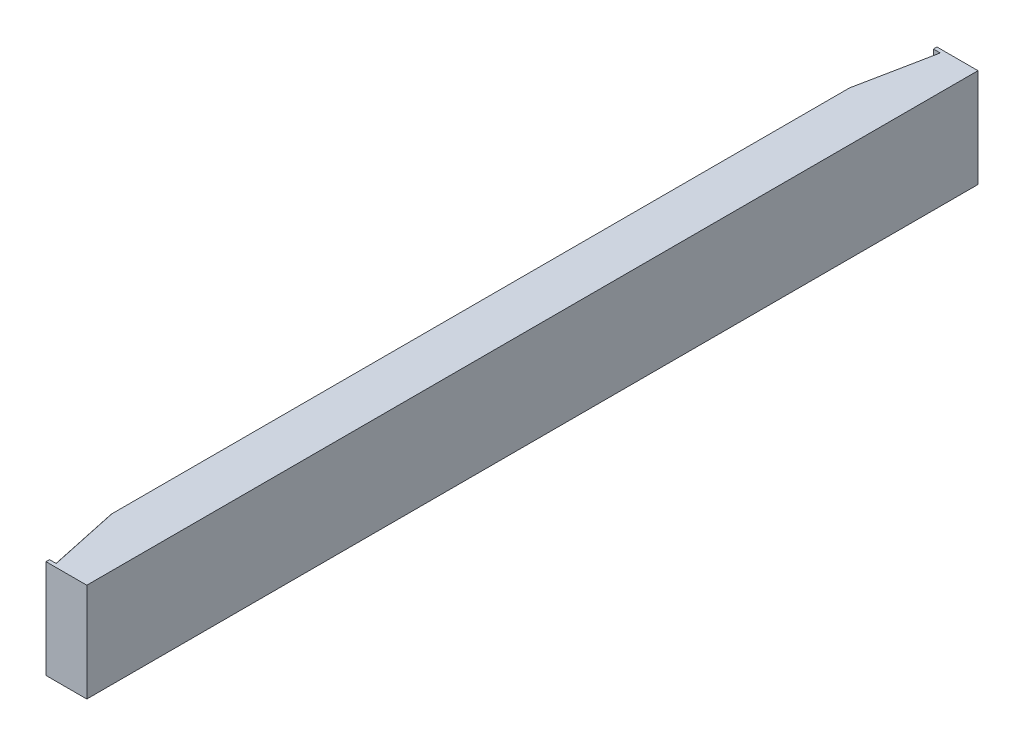
from build123d import *

# Parameters (mm, degrees)
BOSS_EXTRUDE1_DEPTH      = 500
BOSS_EXTRUDE1_DEPTH_BACK = 1600
SKETCH1_W                = 150
SKETCH1_H                = 300
CUT_EXTRUDE1_DEPTH       = 2309
SKETCH5_W                = 150
SKETCH5_H                = 300
BOSS_EXTRUDE2_DEPTH      = 350
SKETCH6_W                = 210
SKETCH6_H                = 250
CUT_EXTRUDE4_DEPTH       = 45
CUT_EXTRUDE5_DEPTH       = 1500
CUT_EXTRUDE7_DEPTH       = 355
FILLET8_R                = 1.5
FILLET9_R                = 1.5
SKETCH9_W                = 150
SKETCH9_H                = 300
BOSS_EXTRUDE3_DEPTH      = 300
SKETCH10_W               = 70
SKETCH10_H               = 230
CUT_EXTRUDE17_DEPTH      = 140
SKETCH11_W               = 125
SKETCH11_H               = 10.75
BOSS_EXTRUDE4_DEPTH      = 300
CUT_EXTRUDE18_DEPTH      = 394
SWEEP1_PROFILE_R         = 7.5
SKETCH50_R               = 4.335134875
BOSS_EXTRUDE5_DEPTH      = 20
CUT_EXTRUDE19_DEPTH      = 30
CUT_EXTRUDE19_DEPTH_BACK = 250
SKETCH82_W               = 45
SKETCH82_H               = 30
CUT_EXTRUDE20_DEPTH      = 32
CUT_EXTRUDE20_DEPTH_BACK = 250
SKETCH85_W               = 45
SKETCH85_H               = 30


with BuildPart() as part:
    # Sketch1 → Boss-Extrude1 (new, two sides: drawn at the far end of the back side and taken through both)
    with BuildSketch(Plane.XY.offset(-BOSS_EXTRUDE1_DEPTH_BACK)):
        with Locations((375, -2.824081205)):
            Rectangle(SKETCH1_W, SKETCH1_H)
    extrude(amount=BOSS_EXTRUDE1_DEPTH + BOSS_EXTRUDE1_DEPTH_BACK)

    # Sketch2 → Cut-Extrude1 (cut)
    with BuildSketch(Plane(origin=(0, 0, -1600), x_dir=(-1, 0, 0), z_dir=(0, 0, -1))):
        Polygon((-300, 49.675918795), (-300, 69.675918795), (-325, 69.675918795), (-325, 77.175918795), (-345, 77.175918795), (-345, 42.175918795), (-325, 42.175918795), (-325, 49.675918795), align=None)
        Polygon((-300, 129.675918795), (-325, 129.675918795), (-325, 137.175918795), (-345, 137.175918795), (-345, 102.175918795), (-325, 102.175918795), (-325, 109.675918795), (-300, 109.675918795), align=None)
        Polygon((-300, -10.324081205), (-300, 9.675918795), (-325, 9.675918795), (-325, 17.175918795), (-345, 17.175918795), (-345, -17.824081205), (-325, -17.824081205), (-325, -10.324081205), align=None)
        Polygon((-300, -70.324081205), (-300, -50.324081205), (-325, -50.324081205), (-325, -42.824081205), (-345, -42.824081205), (-345, -77.824081205), (-325, -77.824081205), (-325, -70.324081205), align=None)
        Polygon((-300, -130.324081205), (-300, -110.324081205), (-325, -110.324081205), (-325, -102.824081205), (-345, -102.824081205), (-345, -137.824081205), (-325, -137.824081205), (-325, -130.324081205), align=None)
    extrude(amount=-CUT_EXTRUDE1_DEPTH, mode=Mode.SUBTRACT)

    # Sketch5 → Boss-Extrude2 (add)
    with BuildSketch(Plane.XY.offset(500)):
        with Locations((375, -2.824081205)):
            Rectangle(SKETCH5_W, SKETCH5_H)
    extrude(amount=BOSS_EXTRUDE2_DEPTH)

    # Sketch6 → Cut-Extrude4 (cut)
    with BuildSketch(Plane.ZY.offset(-300)):
        with Locations((685, -2.824081205)):
            Rectangle(SKETCH6_W, SKETCH6_H)
    extrude(amount=-CUT_EXTRUDE4_DEPTH, mode=Mode.SUBTRACT)

    # Sketch7 → Cut-Extrude5 (cut, symmetric)
    with BuildSketch(Plane.XZ.offset(-122.175918795)):
        Polygon((300, 580), (345, 790), (300, 790), align=None)
    extrude(amount=CUT_EXTRUDE5_DEPTH, both=True, mode=Mode.SUBTRACT)

    # Sketch8 → Cut-Extrude7 (cut)
    with BuildSketch(Plane.XZ.offset(152.824081205)):
        Polygon((450, 850), (450, 800.747642435), (325, 800.747642435), (325, 790), (300, 790), (300, 850), align=None)
    extrude(amount=-CUT_EXTRUDE7_DEPTH, mode=Mode.SUBTRACT)

    # Fillet8
    fillet8_edges = [part.edges().sort_by_distance(p)[0] for p in [
        (325, -2.824081205, 790),
        (325, 147.175918795, 795.373821218),
        (325, -2.824081205, 800.747642435),
        (325, -152.824081205, 795.373821218),
    ]]
    fillet(fillet8_edges, radius=FILLET8_R)

    # Fillet9
    fillet9_edges = [part.edges().sort_by_distance(p)[0] for p in [
        (322.5, -152.824081205, 685),
        (322.5, 147.175918795, 685),
        (322.5, 122.175918795, 685),
        (322.5, -127.824081205, 685),
    ]]
    fillet(fillet9_edges, radius=FILLET9_R)

    # Sketch9 → Boss-Extrude3 (add)
    with BuildSketch(Plane(origin=(0, 0, -1600), x_dir=(-1, 0, 0), z_dir=(0, 0, -1))):
        with Locations((-375, -2.824081205)):
            Rectangle(SKETCH9_W, SKETCH9_H)
    extrude(amount=BOSS_EXTRUDE3_DEPTH)

    # Sketch10 → Cut-Extrude17 (cut, symmetric)
    with BuildSketch(Plane(origin=(0, -2.824081205, 0), x_dir=(-1, 0, 0), z_dir=(0, -1, 0))):
        with Locations((-335, 1785)):
            Rectangle(SKETCH10_W, SKETCH10_H)
    extrude(amount=CUT_EXTRUDE17_DEPTH, both=True, mode=Mode.SUBTRACT)

    # Sketch11 → Boss-Extrude4 (add)
    with BuildSketch(Plane.XZ.offset(152.824081205)):
        with Locations((387.5, -1905.375)):
            Rectangle(SKETCH11_W, SKETCH11_H)
    extrude(amount=-BOSS_EXTRUDE4_DEPTH)

    # Sketch13 → Cut-Extrude18 (cut)
    with BuildSketch(Plane.XZ.offset(152.824081205)):
        Polygon((300, -1900), (345.980080602, -1900), (300, -1670), align=None)
    extrude(amount=-CUT_EXTRUDE18_DEPTH, mode=Mode.SUBTRACT)

    # Sweep1: sweep along a path in Sketch15
    with BuildLine(Plane.XY.offset(-1449.252357565)) as sweep1_path:
        Line((350, -145.902648046), (350, -197.264838167))
        ThreePointArc((350, -197.264838167), (347.071067812, -204.335905979), (340, -207.264838167))
        Line((340, -207.264838167), (304.112930958, -207.264838167))
    # Sweep1 profile (on start of the path) → Sweep1 (sweep)
    with BuildSketch(Plane(origin=(350, -145.902648046, -1449.252357565), x_dir=(0, 0, -1), z_dir=(0, -1, 0))):
        Circle(SWEEP1_PROFILE_R)
    sweep(path=sweep1_path.line)

    # Sketch50 → Boss-Extrude5 (add)
    with BuildSketch(Plane.ZY.offset(-304.112930958)):
        with Locations((-1449.252357565, -207.264838167)):
            Circle(SKETCH50_R)
    extrude(amount=BOSS_EXTRUDE5_DEPTH)

    # Sketch82 → Cut-Extrude19 (cut, two sides: drawn at the far end of the back side and taken through both)
    with BuildSketch(Plane.XZ.offset(110.324081205).offset(-CUT_EXTRUDE19_DEPTH_BACK)):
        with Locations((322.5, -1545)):
            Rectangle(SKETCH82_W, SKETCH82_H)
    extrude(amount=CUT_EXTRUDE19_DEPTH + CUT_EXTRUDE19_DEPTH_BACK, mode=Mode.SUBTRACT)

    # Sketch85 → Cut-Extrude20 (cut, two sides: drawn at the far end of the back side and taken through both)
    with BuildSketch(Plane.XZ.offset(110.324081205).offset(-CUT_EXTRUDE20_DEPTH_BACK)):
        with Locations((322.5, 445)):
            Rectangle(SKETCH85_W, SKETCH85_H)
    extrude(amount=CUT_EXTRUDE20_DEPTH + CUT_EXTRUDE20_DEPTH_BACK, mode=Mode.SUBTRACT)


solid = part.part
